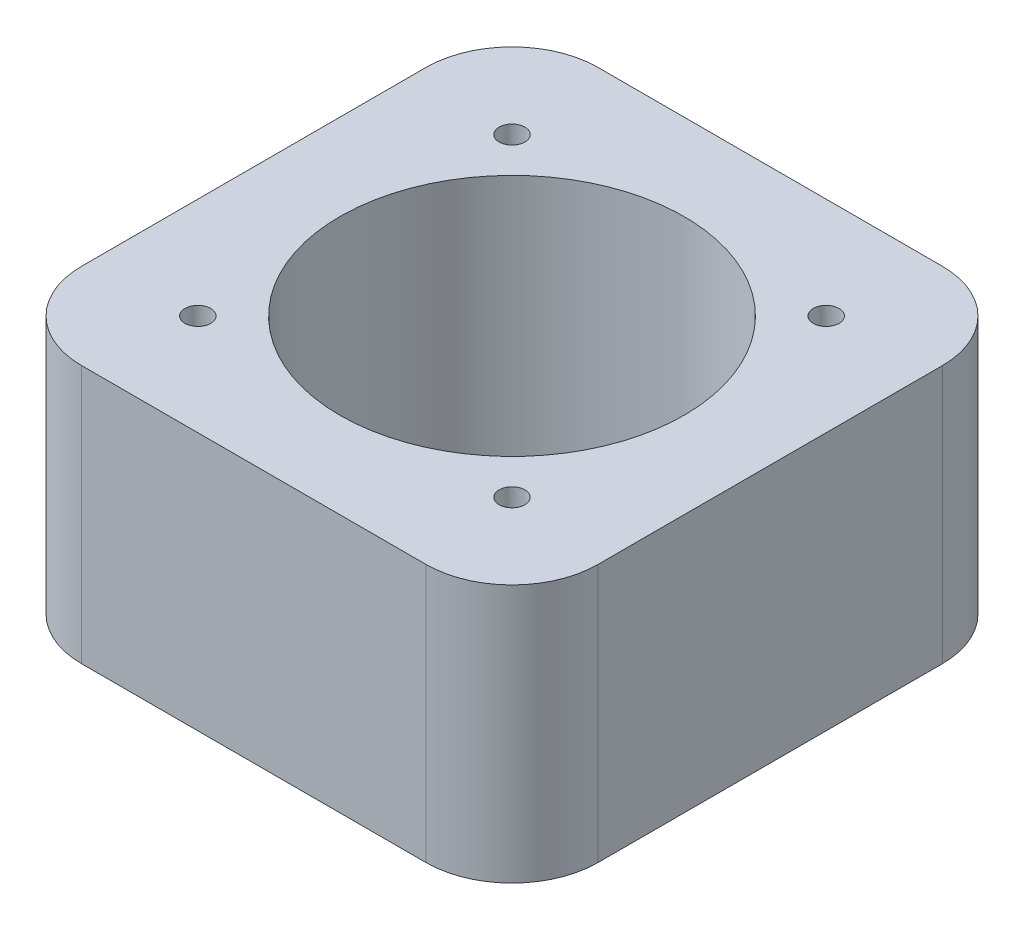
from build123d import *

# Parameters (mm, degrees)
SKETCH1_W           = 60
SKETCH1_H           = 60
SKETCH1_R           = 20
SKETCH1_R_2         = 1.5
BOSS_EXTRUDE1_DEPTH = 30
FILLET1_R           = 10
SKETCH2_R           = 6.25
CUT_EXTRUDE1_DEPTH  = 5
SKETCH3_R           = 2.5
CUT_EXTRUDE4_DEPTH  = 1
SKETCH4_R           = 0.5
CUT_EXTRUDE5_DEPTH  = 2


with BuildPart() as part:
    # Sketch1 → Boss-Extrude1 (new body)
    with BuildSketch(Plane(origin=(0, 0, 0), x_dir=(1, 0, 0), z_dir=(0, 1, 0))):
        with Locations((30, 30)):
            Rectangle(SKETCH1_W, SKETCH1_H)
        with Locations(Location((30, 30, 0), (0, 0, 270))):
            Circle(SKETCH1_R, mode=Mode.SUBTRACT)
        with Locations(Location((48.25, 48.25, 0), (0, 0, 270))):
            Circle(SKETCH1_R_2, mode=Mode.SUBTRACT)
        with Locations(Location((11.75, 48.25, 0), (0, 0, 270))):
            Circle(SKETCH1_R_2, mode=Mode.SUBTRACT)
        with Locations(Location((11.75, 11.75, 0), (0, 0, 270))):
            Circle(SKETCH1_R_2, mode=Mode.SUBTRACT)
        with Locations(Location((48.25, 11.75, 0), (0, 0, 270))):
            Circle(SKETCH1_R_2, mode=Mode.SUBTRACT)
    extrude(amount=BOSS_EXTRUDE1_DEPTH)

    # Fillet1
    fillet1_edges = [part.edges().sort_by_distance(p)[0] for p in [
        (0, 15, -60),
        (60, 15, -60),
        (60, 15, 0),
        (0, 15, 0),
    ]]
    fillet(fillet1_edges, radius=FILLET1_R)

    # Sketch2 → Cut-Extrude1 (cut)
    with BuildSketch(Plane.ZY):
        with BuildLine():
            Line((-34.062019202, 19.75), (-48.409222121, 17.476665185))
            ThreePointArc((-48.409222121, 17.476665185), (-46.865597615, 16.642871769), (-46.25, 15))
            ThreePointArc((-46.25, 15), (-46.865597615, 13.357128231), (-48.409222121, 12.523334815))
            Line((-48.409222121, 12.523334815), (-34.062019202, 10.25))
            ThreePointArc((-34.062019202, 10.25), (-36.25, 15), (-34.062019202, 19.75))
        make_face()
        with Locations((-30, 15)):
            Circle(SKETCH2_R)
        with BuildLine():
            Line((-11.590777879, 17.476665185), (-25.937980798, 19.75))
            ThreePointArc((-25.937980798, 19.75), (-24.323287923, 17.614849899), (-23.75, 15))
            ThreePointArc((-23.75, 15), (-24.323287923, 12.385150101), (-25.937980798, 10.25))
            Line((-25.937980798, 10.25), (-11.590777879, 12.523334815))
            ThreePointArc((-11.590777879, 12.523334815), (-13.75, 15), (-11.590777879, 17.476665185))
        make_face()
        with BuildLine():
            Line((-10.160275264, 17.25), (-11.590777879, 17.476665185))
            ThreePointArc((-11.590777879, 17.476665185), (-13.75, 15), (-11.590777879, 12.523334815))
            Line((-11.590777879, 12.523334815), (-10.160275264, 12.75))
            ThreePointArc((-10.160275264, 12.75), (-10.079367047, 12.791014149), (-10, 12.834936491))
            Line((-10, 12.834936491), (-10, 17.165063509))
            ThreePointArc((-10, 17.165063509), (-10.079367047, 17.208985851), (-10.160275264, 17.25))
        make_face()
        with BuildLine():
            ThreePointArc((-8.75, 15), (-9.084936491, 16.25), (-10, 17.165063509))
            Line((-10, 17.165063509), (-10, 12.834936491))
            ThreePointArc((-10, 12.834936491), (-9.084936491, 13.75), (-8.75, 15))
        make_face()
        with BuildLine():
            Line((-48.409222121, 17.476665185), (-49.839724736, 17.25))
            ThreePointArc((-49.839724736, 17.25), (-49.920632953, 17.208985851), (-50, 17.165063509))
            Line((-50, 17.165063509), (-50, 12.834936491))
            ThreePointArc((-50, 12.834936491), (-49.920632953, 12.791014149), (-49.839724736, 12.75))
            Line((-49.839724736, 12.75), (-48.409222121, 12.523334815))
            ThreePointArc((-48.409222121, 12.523334815), (-46.865597615, 13.357128231), (-46.25, 15))
            ThreePointArc((-46.25, 15), (-46.865597615, 16.642871769), (-48.409222121, 17.476665185))
        make_face()
        with BuildLine():
            Line((-50, 12.834936491), (-50, 17.165063509))
            ThreePointArc((-50, 17.165063509), (-51.25, 15), (-50, 12.834936491))
        make_face()
    extrude(amount=-CUT_EXTRUDE1_DEPTH, mode=Mode.SUBTRACT)

    # Sketch3 → Cut-Extrude4 (cut)
    with BuildSketch(Plane.ZY.offset(-5)):
        with Locations((-30, 15)):
            Circle(SKETCH3_R)
    extrude(amount=-CUT_EXTRUDE4_DEPTH, mode=Mode.SUBTRACT)

    # Sketch4 → Cut-Extrude5 (cut)
    with BuildSketch(Plane.ZY.offset(-5)):
        with Locations((-12, 15)):
            Circle(SKETCH4_R)
        with Locations((-48, 15)):
            Circle(SKETCH4_R)
    extrude(amount=-CUT_EXTRUDE5_DEPTH, mode=Mode.SUBTRACT)


solid = part.part
